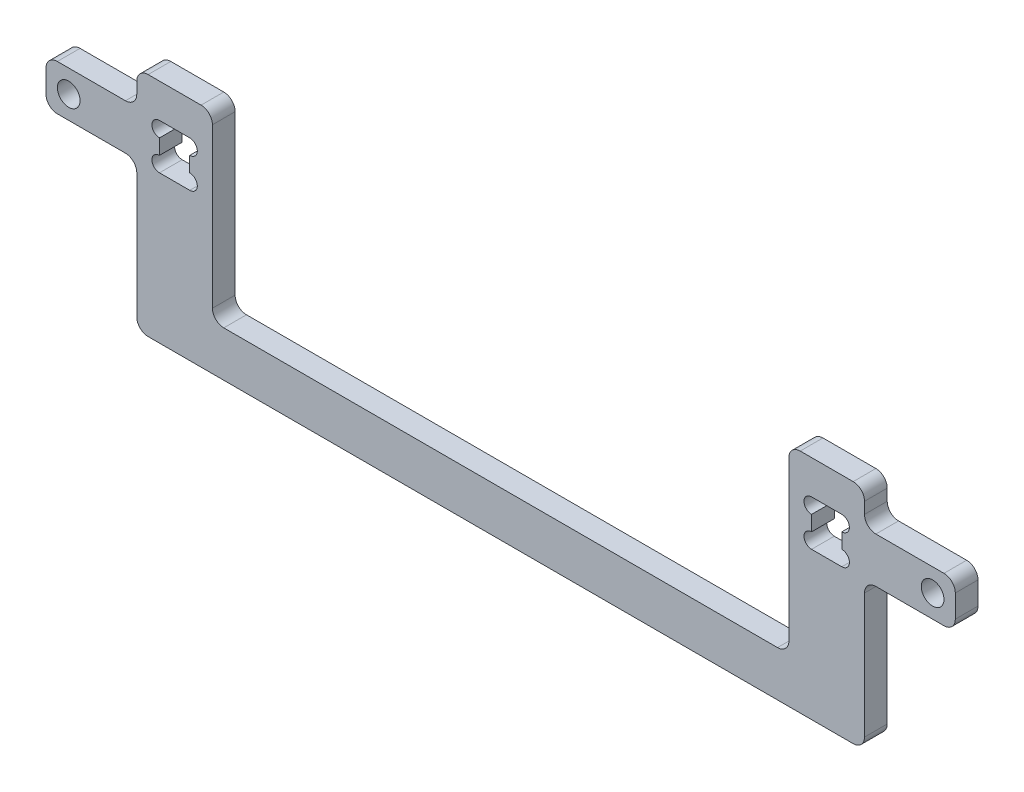
from build123d import *

# Parameters (mm, degrees)
EXTRUDE_1_DEPTH     = 3
SKETCH_2_W          = 8
SKETCH_2_H          = 4.5
SKETCH_2_H_2        = 13.5
CUT_EXTRUDE_1_DEPTH = 3
SKETCH_4_W          = 76.2
SKETCH_4_H          = 6
CUT_EXTRUDE_2_DEPTH = 3
SKETCH_6_W          = 12
SKETCH_6_H          = 6
EXTRUDE_2_DEPTH     = 3
FILLET_1_R          = 1.5
SKETCH_7_R          = 1.5
CUT_EXTRUDE_3_DEPTH = 10


with BuildPart() as part:
    # 草图1 → 凸台-拉伸1 (new body)
    with BuildSketch(Plane.XY):
        Polygon((18, 0), (18, -24), (78.2, -24), (78.2, 0), (96.2, 0), (96.2, -30), (0, -30), (0, 0), align=None)
        with BuildLine():
            Line((3, -4.5), (7, -4.5))
            ThreePointArc((7, -4.5), (8, -5.5), (7, -6.5))
            Line((7, -6.5), (7, -8.5))
            ThreePointArc((7, -8.5), (8, -9.5), (7, -10.5))
            Line((7, -10.5), (3, -10.5))
            ThreePointArc((3, -10.5), (2, -9.5), (3, -8.5))
            Line((3, -8.5), (3, -6.5))
            ThreePointArc((3, -6.5), (2, -5.5), (3, -4.5))
        make_face(mode=Mode.SUBTRACT)
        with BuildLine():
            Line((89.2, -6.5), (89.2, -8.5))
            ThreePointArc((89.2, -8.5), (88.2, -9.5), (89.2, -10.5))
            Line((89.2, -10.5), (93.2, -10.5))
            ThreePointArc((93.2, -10.5), (94.2, -9.5), (93.2, -8.5))
            Line((93.2, -8.5), (93.2, -6.5))
            ThreePointArc((93.2, -6.5), (94.2, -5.5), (93.2, -4.5))
            Line((93.2, -4.5), (89.2, -4.5))
            ThreePointArc((89.2, -4.5), (88.2, -5.5), (89.2, -6.5))
        make_face(mode=Mode.SUBTRACT)
    extrude(amount=EXTRUDE_1_DEPTH)

    # 草图2 → 切除-拉伸1 (cut)
    with BuildSketch(Plane.XY.offset(3)):
        with Locations((14, -2.25)):
            Rectangle(SKETCH_2_W, SKETCH_2_H)
        with Locations((14, -17.25)):
            Rectangle(SKETCH_2_W, SKETCH_2_H_2)
        with Locations((82.2, -17.25)):
            Rectangle(SKETCH_2_W, SKETCH_2_H_2)
        with Locations((82.2, -2.25)):
            Rectangle(SKETCH_2_W, SKETCH_2_H)
    extrude(amount=-CUT_EXTRUDE_1_DEPTH, mode=Mode.SUBTRACT)

    # 草图4 → 切除-拉伸2 (cut)
    with BuildSketch(Plane.XY.offset(3)):
        with Locations((48.1, -7.5)):
            Rectangle(SKETCH_4_W, SKETCH_4_H)
    extrude(amount=-CUT_EXTRUDE_2_DEPTH, mode=Mode.SUBTRACT)

    # 草图6 → 凸台-拉伸2 (add)
    with BuildSketch(Plane.XY.offset(3)):
        with Locations((102.2, -7.5)):
            Rectangle(SKETCH_6_W, SKETCH_6_H)
        with Locations((-6, -7.5)):
            Rectangle(SKETCH_6_W, SKETCH_6_H)
    extrude(amount=-EXTRUDE_2_DEPTH)

    # 圆角1
    fillet_1_edges = [part.edges().sort_by_distance(p)[0] for p in [
        (10, -24, 1.5),
        (10, 0, 1.5),
        (0, 0, 1.5),
        (96.2, 0, 1.5),
        (96.2, -30, 1.5),
        (0, -30, 1.5),
        (96.2, -10.5, 1.5),
        (96.2, -4.5, 1.5),
        (108.2, -4.5, 1.5),
        (108.2, -10.5, 1.5),
        (-12, -4.5, 1.5),
        (0, -4.5, 1.5),
        (0, -10.5, 1.5),
        (-12, -10.5, 1.5),
        (86.2, 0, 1.5),
        (86.2, -24, 1.5),
    ]]
    fillet(fillet_1_edges, radius=FILLET_1_R)

    # 草图7 → 切除-拉伸3 (cut)
    with BuildSketch(Plane.XY.offset(3)):
        with Locations((-9, -7.5)):
            Circle(SKETCH_7_R)
        with Locations((105.2, -7.5)):
            Circle(SKETCH_7_R)
    extrude(amount=-CUT_EXTRUDE_3_DEPTH, mode=Mode.SUBTRACT)


solid = part.part
